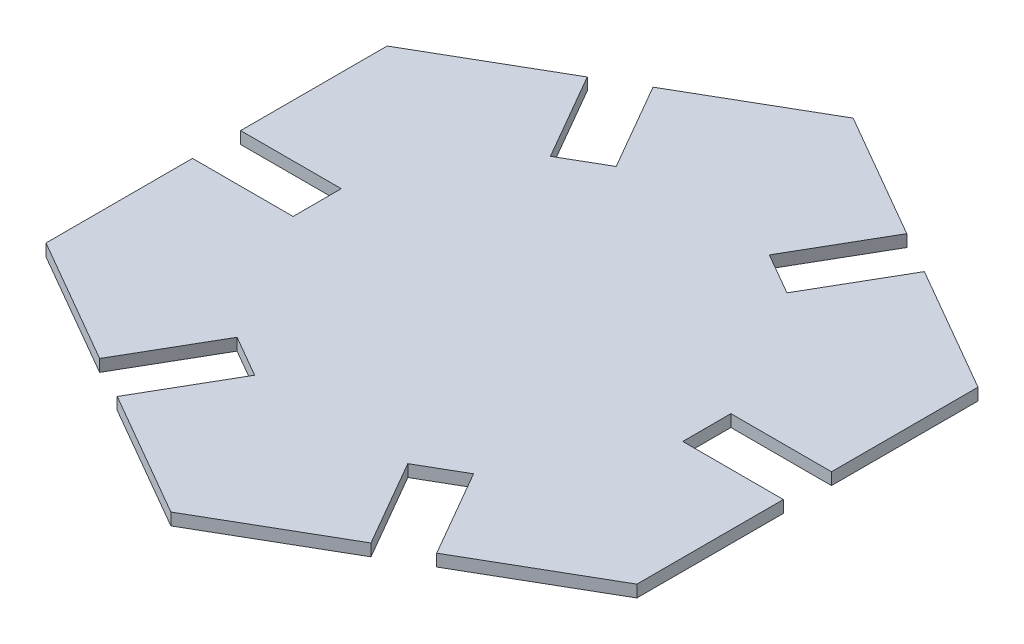
from build123d import *

# Parameters (mm, degrees)
BOSS_EXTRUDE1_DEPTH = 1.5875
SKETCH2_W           = 13.27114317
SKETCH2_H           = 6.35
CUT_EXTRUDE1_DEPTH  = 71.000903906


with BuildPart() as part:
    # Sketch1 → Boss-Extrude1 (new body)
    with BuildSketch(Plane(origin=(0, 0, 0), x_dir=(1, 0, 0), z_dir=(0, 1, 0))):
        Polygon((26.221215583, 24.643793134), (-12.749927587, 47.143793134), (-51.721070757, 24.643793134), (-51.721070757, -20.356206866), (-12.749927587, -42.856206866), (26.221215583, -20.356206866), align=None)
    extrude(amount=BOSS_EXTRUDE1_DEPTH)

    # Sketch2 → Cut-Extrude1 (cut, through all)
    with BuildSketch(Plane(origin=(0, 1.5875, 0), x_dir=(1, 0, 0), z_dir=(0, 1, 0))):
        with Locations((19.585643998, 2.143793134)):
            Rectangle(SKETCH2_W, SKETCH2_H)
        Polygon((2.84970307, 22.813146011), (9.485274655, 34.306293134), (3.986013341, 37.481293134), (-2.649558244, 25.988146011), align=None)
        Polygon((-22.85029693, 25.988146011), (-29.485868515, 37.481293134), (-34.985129829, 34.306293134), (-28.349558244, 22.813146011), align=None)
        with Locations((-45.085499172, 2.143793134)):
            Rectangle(SKETCH2_W, SKETCH2_H)
        Polygon((3.986013341, -33.193706866), (9.485274655, -30.018706866), (2.84970307, -18.525559743), (-2.649558244, -21.700559743), align=None)
        Polygon((-34.985129829, -30.018706866), (-29.485868515, -33.193706866), (-22.85029693, -21.700559743), (-28.349558244, -18.525559743), align=None)
    extrude(amount=-CUT_EXTRUDE1_DEPTH, mode=Mode.SUBTRACT)


solid = part.part
